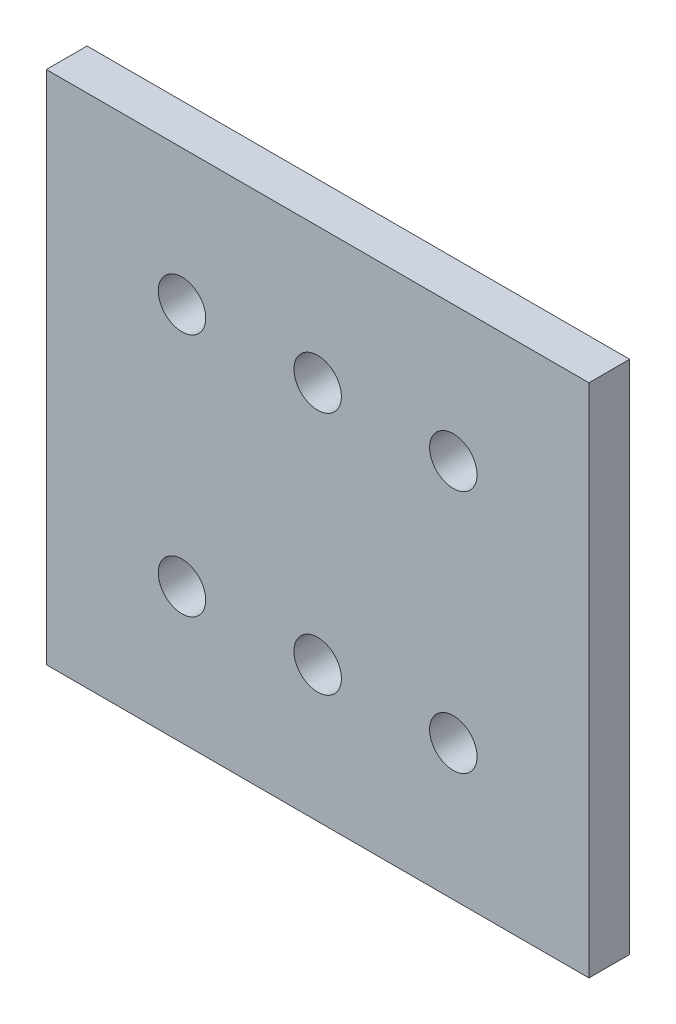
from build123d import *

# Parameters (mm, degrees)
SKETCH1_W           = 40
SKETCH1_H           = 38
SKETCH1_R           = 1.75
BOSS_EXTRUDE1_DEPTH = 3


with BuildPart() as part:
    # Sketch1 → Boss-Extrude1 (new body)
    with BuildSketch(Plane.XY):
        with Locations((20, 19)):
            Rectangle(SKETCH1_W, SKETCH1_H)
        with Locations((10, 10)):
            Circle(SKETCH1_R, mode=Mode.SUBTRACT)
        with Locations((20, 10)):
            Circle(SKETCH1_R, mode=Mode.SUBTRACT)
        with Locations((30, 10)):
            Circle(SKETCH1_R, mode=Mode.SUBTRACT)
        with Locations((10, 28)):
            Circle(SKETCH1_R, mode=Mode.SUBTRACT)
        with Locations((20, 28)):
            Circle(SKETCH1_R, mode=Mode.SUBTRACT)
        with Locations((30, 28)):
            Circle(SKETCH1_R, mode=Mode.SUBTRACT)
    extrude(amount=BOSS_EXTRUDE1_DEPTH)


solid = part.part
